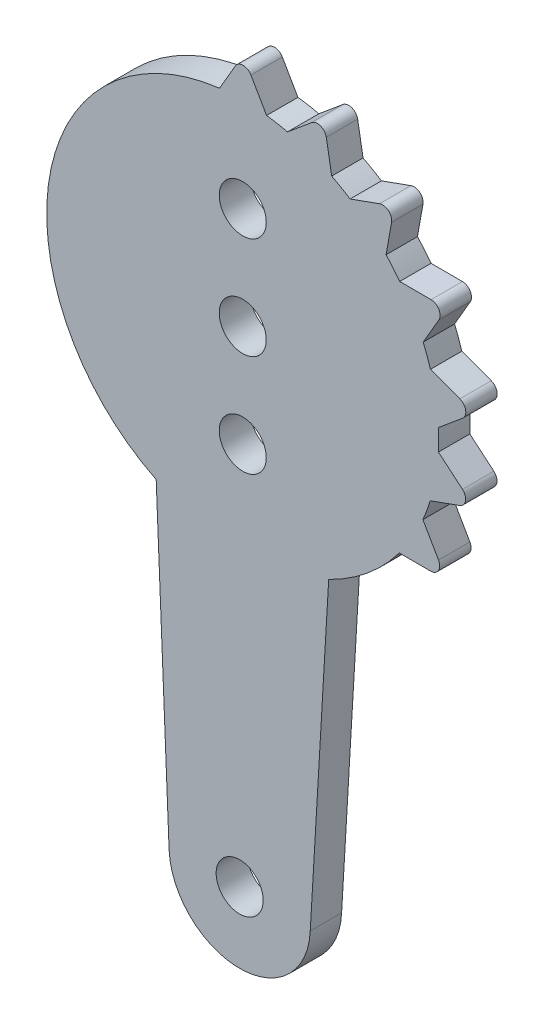
from build123d import *

# Parameters (mm, degrees)
SKETCH1_R           = 1.5
BOSS_EXTRUDE1_DEPTH = 2


with BuildPart() as part:
    # Sketch1 → Boss-Extrude1 (new body)
    with BuildSketch(Plane.XY):
        with BuildLine():
            Line((-5.322767432, 19.832757644), (-4.500006862, -0.184957582))
            ThreePointArc((-4.500006862, -0.184957582), (-0.000167017, -4.503806283), (4.499993132, -0.185291335))
            Line((4.499993132, -0.185291335), (5.67721776, 19.814708665))
            ThreePointArc((5.67721776, 19.814708665), (8.148561948, 21.404983206), (10.180318916, 23.528301089))
            Line((10.180318916, 23.528301089), (12.180312779, 23.523346368))
            ThreePointArc((12.180312779, 23.523346368), (12.679597114, 23.812434692), (12.680312779, 24.389371772))
            Line((12.680312779, 24.389371772), (11.684612917, 26.123898158))
            ThreePointArc((11.684612917, 26.123898158), (11.934719035, 26.754030681), (12.150293859, 27.396796239))
            Line((12.150293859, 27.396796239), (14.031367948, 28.076178512))
            ThreePointArc((14.031367948, 28.076178512), (14.401667723, 28.518597977), (14.205016126, 29.060986265))
            Line((14.205016126, 29.060986265), (12.67612135, 30.350358501))
            ThreePointArc((12.67612135, 30.350358501), (12.695626208, 31.028030714), (12.678361511, 31.705763698))
            Line((12.678361511, 31.705763698), (14.213630529, 32.987539436))
            ThreePointArc((14.213630529, 32.987539436), (14.410282126, 33.529927724), (14.039982351, 33.972347189))
            Line((14.039982351, 33.972347189), (12.162299935, 34.661047954))
            ThreePointArc((12.162299935, 34.661047954), (11.948850959, 35.304522586), (11.700829119, 35.935478396))
            Line((11.700829119, 35.935478396), (12.705116964, 37.665046528))
            ThreePointArc((12.705116964, 37.665046528), (12.704401299, 38.241983607), (12.205116964, 38.531071932))
            Line((12.205116964, 38.531071932), (10.205123119, 38.536033749))
            ThreePointArc((10.205123119, 38.536033749), (9.784465406, 39.067698263), (9.335601516, 39.575774317))
            Line((9.335601516, 39.575774317), (9.687776253, 41.5445234))
            ThreePointArc((9.687776253, 41.5445234), (9.489779645, 42.086422145), (8.92173181, 42.18731101))
            Line((8.92173181, 42.18731101), (7.040655311, 41.507935412))
            ThreePointArc((7.040655311, 41.507935412), (6.463526388, 41.863663221), (5.867960059, 42.187578047))
            Line((5.867960059, 42.187578047), (5.525544216, 44.158047887))
            ThreePointArc((5.525544216, 44.158047887), (5.154147979, 44.59954731), (4.585851596, 44.500068031))
            Line((4.585851596, 44.500068031), (3.050578029, 43.21829774))
            ThreePointArc((3.050578029, 43.21829774), (2.386588163, 43.355182821), (1.716153483, 43.455867511))
            Line((1.716153483, 43.455867511), (0.720447466, 45.190390364))
            ThreePointArc((0.720447466, 45.190390364), (0.220447466, 45.47823912), (-0.279552534, 45.190390364))
            Line((-0.279552534, 45.190390364), (-1.283846517, 43.460825796))
            ThreePointArc((-1.283846517, 43.460825796), (-12.125641313, 33.154858755), (-5.322767432, 19.832757644))
        make_face()
        with Locations((0.19564328, 31.048690205)):
            Circle(SKETCH1_R, mode=Mode.SUBTRACT)
        with Locations((0.19564328, 37.548690205)):
            Circle(SKETCH1_R, mode=Mode.SUBTRACT)
        with Locations((0.19564328, 24.548690205)):
            Circle(SKETCH1_R, mode=Mode.SUBTRACT)
        Circle(SKETCH1_R, mode=Mode.SUBTRACT)
    extrude(amount=BOSS_EXTRUDE1_DEPTH)


solid = part.part
